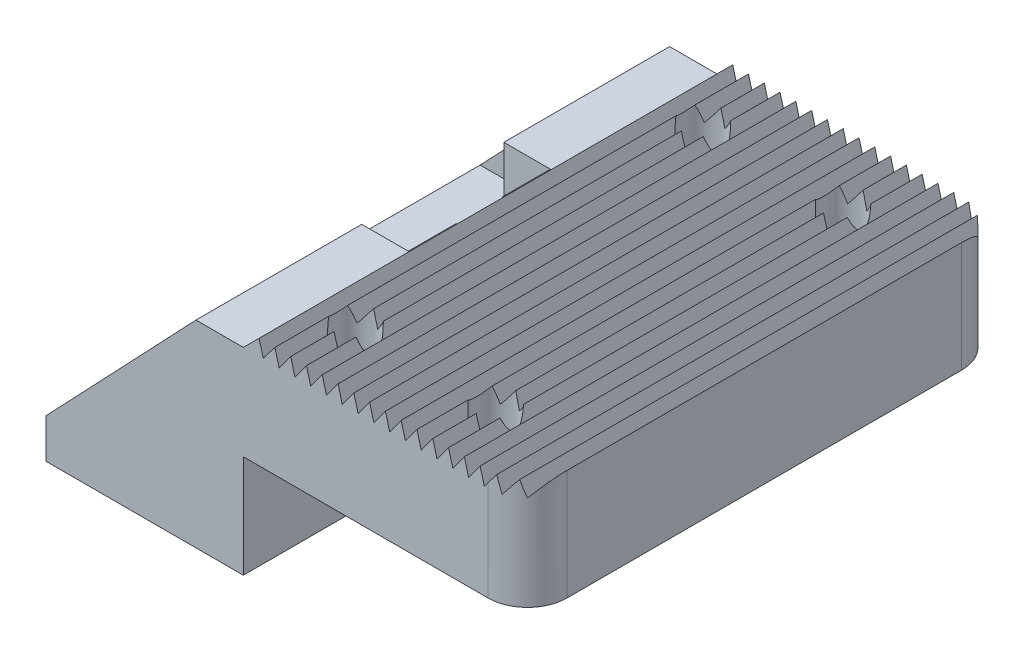
from build123d import *

# Parameters (mm, degrees)
EXTRUDE_1_DEPTH     = 60
FILLET_1_R          = 5
SKETCH_3_R          = 2.5
CUT_EXTRUDE_2_DEPTH = 77.472217177
CUT_EXTRUDE_4_DEPTH = 6
SKETCH_6_W          = 18
SKETCH_6_H          = 20
CUT_EXTRUDE_5_DEPTH = 5.9
SKETCH_7_R          = 2.5
EXTRUDE_2_DEPTH     = 5
CUT_EXTRUDE_START   = -8
CUT_EXTRUDE_6_DEPTH = 8
EXTRUDE_3_DEPTH     = 5
EXTRUDE_4_DEPTH     = 5
EXTRUDE_5_DEPTH     = 45
CUT_EXTRUDE_7_DEPTH = 15


with BuildPart() as part:
    # 草图1 → 凸台-拉伸1 (new body)
    with BuildSketch(Plane.XY):
        Polygon((0, 9), (0, -11), (42, -11), (42, 11), (40.535898385, 9), (40, 11), (38.535898385, 9), (38, 11), (36.535898385, 9), (36, 11), (34.535898385, 9), (34, 11), (32.535898385, 9), (32, 11), (30.535898385, 9), (30, 11), (28.535898385, 9), (28, 11), (26.535898385, 9), (26, 11), (24.535898385, 9), (24, 11), (22.535898385, 9), (22, 11), (20.535898385, 9), (20, 11), (18.535898385, 9), (18, 11), (16.535898385, 9), (16, 11), (14.535898385, 9), (14, 11), (12.535898385, 9), (12, 11), (10.535898385, 9), (10, 11), (8.51763809, 9.068148347), (8, 11), (6, 9), align=None)
    extrude(amount=EXTRUDE_1_DEPTH)

    # 圆角1
    fillet_1_edges = [part.edges().sort_by_distance(p)[0] for p in [
        (42, 0, 0),
        (42, 0, 60),
    ]]
    fillet(fillet_1_edges, radius=FILLET_1_R)

    # 草图3 → 切除-拉伸2 (cut, through all)
    with BuildSketch(Plane.XZ.offset(11)):
        with Locations(Location((30, 8, 0), (0, 0, 270))):
            Circle(SKETCH_3_R)
        with BuildLine():
            ThreePointArc((14.7, 52), (13.967766953, 53.767766953), (12.2, 54.5))
            Line((12.2, 54.5), (12.2, 49.5))
            ThreePointArc((12.2, 49.5), (13.967766953, 50.232233047), (14.7, 52))
        make_face()
        with BuildLine():
            Line((12.2, 49.5), (12.2, 54.5))
            ThreePointArc((12.2, 54.5), (9.7, 52), (12.2, 49.5))
        make_face()
        with BuildLine():
            ThreePointArc((14.7, 8), (13.967766953, 9.767766953), (12.2, 10.5))
            Line((12.2, 10.5), (12.2, 5.5))
            ThreePointArc((12.2, 5.5), (13.967766953, 6.232233047), (14.7, 8))
        make_face()
        with BuildLine():
            Line((12.2, 5.5), (12.2, 10.5))
            ThreePointArc((12.2, 10.5), (9.7, 8), (12.2, 5.5))
        make_face()
        with Locations(Location((30, 52, 0), (0, 0, 270))):
            Circle(SKETCH_3_R)
    extrude(amount=-CUT_EXTRUDE_2_DEPTH, mode=Mode.SUBTRACT)

    # 草图5 → 切除-拉伸4 (cut)
    with BuildSketch(Plane.ZY):
        with BuildLine():
            Line((27.05, 9), (32.95, 9))
            ThreePointArc((32.95, 9), (30, 6.05), (27.05, 9))
        make_face()
    extrude(amount=-CUT_EXTRUDE_4_DEPTH, mode=Mode.SUBTRACT)

    # 草图6 → 切除-拉伸5 (cut)
    with BuildSketch(Plane.ZY):
        with Locations((30, -1)):
            Rectangle(SKETCH_6_W, SKETCH_6_H)
    extrude(amount=-CUT_EXTRUDE_5_DEPTH, mode=Mode.SUBTRACT)

    # 草图8 → 切除-拉伸6 (cut)
    with BuildSketch(Plane.XZ.offset(11).offset(CUT_EXTRUDE_START)):
        with BuildLine():
            Line((6, 60), (6, 0))
            Line((6, 0), (37, 0))
            ThreePointArc((37, 0), (40.535533906, 1.464466094), (42, 5))
            Line((42, 5), (42, 55))
            ThreePointArc((42, 55), (40.535533906, 58.535533906), (37, 60))
            Line((37, 60), (6, 60))
        make_face()
    extrude(amount=CUT_EXTRUDE_6_DEPTH, mode=Mode.SUBTRACT)



with BuildPart() as body_2:
    # 草图7 → 凸台-拉伸2 (new body)
    # profile 1 of 3: a face of its own
    with BuildSketch(Plane.XZ.offset(11)):
        Polygon((0, 39), (0, 60), (-19, 60), (-19, 0), (0, 0), (0, 21), (5.9, 21), (5.9, 30), (5.9, 39), align=None)
        with Locations((-7, 14)):
            Circle(SKETCH_7_R, mode=Mode.SUBTRACT)
        with Locations((-7, 46)):
            Circle(SKETCH_7_R, mode=Mode.SUBTRACT)
    # profile 2 of 3: a face of its own
    with BuildSketch(Plane.XZ.offset(11)):
        Polygon((6, 30), (6, 60), (0, 60), (0, 39), (5.9, 39), (5.9, 30), align=None)
    # profile 3 of 3: a face of its own
    with BuildSketch(Plane.XZ.offset(11)):
        Polygon((6, 0), (6, 30), (5.9, 30), (5.9, 21), (0, 21), (0, 0), align=None)
    extrude(amount=EXTRUDE_2_DEPTH)


with BuildPart() as part_1:
    add(part.part)

    add(body_2.part)  # 凸台-拉伸3 merges body 2
    # 草图9 → 凸台-拉伸3 (add)
    with BuildSketch(Plane.XY.offset(60)):
        Polygon((0, 9), (-19, -11), (0, -11), align=None)
    extrude(amount=-EXTRUDE_3_DEPTH)

    # 草图10 → 凸台-拉伸4 (add)
    with BuildSketch(Plane(origin=(0, 0, 0), x_dir=(-1, 0, 0), z_dir=(0, 0, -1))):
        Polygon((0, 9), (0, -11), (19, -11), align=None)
    extrude(amount=-EXTRUDE_4_DEPTH)

    # 草图11 → 凸台-拉伸5 (add)
    with BuildSketch(Plane.XY.offset(60)):
        Polygon((6, -3), (6, -16), (37, -3), align=None)
    extrude(amount=-EXTRUDE_5_DEPTH)

    # 草图12 → 切除-拉伸7 (cut)
    with BuildSketch(Plane.XY.offset(60)):
        Polygon((37, -3), (6, -3), (6, -16), align=None)
    extrude(amount=-CUT_EXTRUDE_7_DEPTH, mode=Mode.SUBTRACT)


solid = part_1.part
